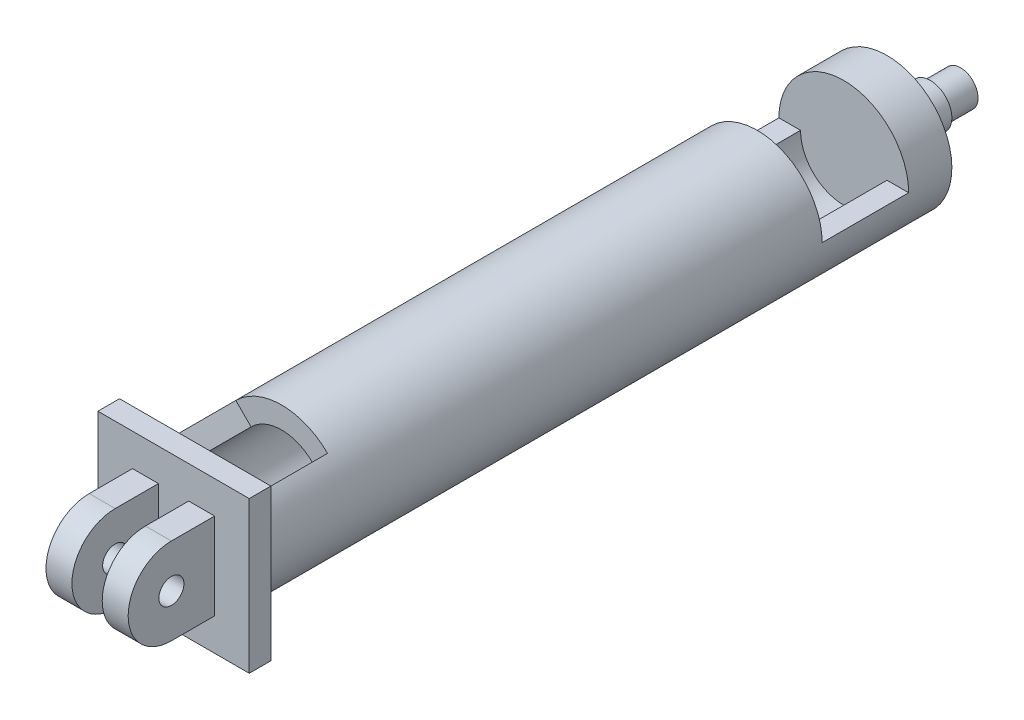
from build123d import *

# Parameters (mm, degrees)
SKETCH1_R           = 15
SKETCH1_R_2         = 10
BOSS_EXTRUDE1_DEPTH = 150
SKETCH2_W           = 35
SKETCH2_H           = 35
BOSS_EXTRUDE2_DEPTH = 5
CUT_EXTRUDE5_DEPTH  = 20
BOSS_EXTRUDE4_START = 10
SKETCH12_R          = 15
BOSS_EXTRUDE4_DEPTH = 10
SKETCH13_R          = 5
BOSS_EXTRUDE5_DEPTH = 10
CUT_EXTRUDE6_START  = 20
CUT_EXTRUDE6_DEPTH  = 20
SKETCH15_R          = 4.05
BOSS_EXTRUDE6_DEPTH = 7
SKETCH16_R          = 2.9
BOSS_EXTRUDE7_DEPTH = 35
SKETCH17_W          = 8
SKETCH17_H          = 27.5
SKETCH17_H_2        = 7.5
SKETCH17_W_2        = 7
CUT_EXTRUDE7_DEPTH  = 184.674984688
CUT_EXTRUDE11_DEPTH = 50
CUT_EXTRUDE13_START = 3
CUT_EXTRUDE13_DEPTH = 3


with BuildPart() as part:
    # Sketch1 → Boss-Extrude1 (new body)
    with BuildSketch(Plane.XY):
        Circle(SKETCH1_R)
        Circle(SKETCH1_R_2, mode=Mode.SUBTRACT)
    extrude(amount=BOSS_EXTRUDE1_DEPTH)

    # Sketch2 → Boss-Extrude2 (add)
    with BuildSketch(Plane.XY.offset(150)):
        Rectangle(SKETCH2_W, SKETCH2_H)
    extrude(amount=BOSS_EXTRUDE2_DEPTH)

    # Sketch10 → Cut-Extrude5 (cut)
    with BuildSketch(Plane(origin=(0, 0, 0), x_dir=(-1, 0, 0), z_dir=(0, 0, -1))):
        with BuildLine():
            Line((10, 0), (15, 0))
            ThreePointArc((15, 0), (0, 15), (-15, 0))
            Line((-15, 0), (-10, 0))
            ThreePointArc((-10, 0), (0, 10), (10, 0))
        make_face()
    extrude(amount=-CUT_EXTRUDE5_DEPTH, mode=Mode.SUBTRACT)

    # Sketch12 → Boss-Extrude4 (add)
    with BuildSketch(Plane(origin=(0, 0, 0), x_dir=(-1, 0, 0), z_dir=(0, 0, -1)).offset(BOSS_EXTRUDE4_START)):
        Circle(SKETCH12_R)
    extrude(amount=-BOSS_EXTRUDE4_DEPTH)

    # Sketch13 → Boss-Extrude5 (add)
    with BuildSketch(Plane(origin=(0, 0, -10), x_dir=(-1, 0, 0), z_dir=(0, 0, -1))):
        Circle(SKETCH13_R)
    extrude(amount=BOSS_EXTRUDE5_DEPTH)

    # Sketch14 → Cut-Extrude6 (cut)
    with BuildSketch(Plane(origin=(0, 0, 150), x_dir=(-1, 0, 0), z_dir=(0, 0, -1)).offset(CUT_EXTRUDE6_START)):
        with BuildLine():
            Line((-10.606601718, 10.606601718), (-7.071067812, 7.071067812))
            ThreePointArc((-7.071067812, 7.071067812), (0, 10), (7.071067812, 7.071067812))
            Line((7.071067812, 7.071067812), (10.606601718, 10.606601718))
            ThreePointArc((10.606601718, 10.606601718), (0, 15), (-10.606601718, 10.606601718))
        make_face()
    extrude(amount=-CUT_EXTRUDE6_DEPTH, mode=Mode.SUBTRACT)

    # Sketch15 → Boss-Extrude6 (add)
    with BuildSketch(Plane(origin=(0, 0, -20), x_dir=(-1, 0, 0), z_dir=(0, 0, -1))):
        Circle(SKETCH15_R)
    extrude(amount=BOSS_EXTRUDE6_DEPTH)

    # Sketch16 → Boss-Extrude7 (add)
    with BuildSketch(Plane.ZY.offset(17.5)):
        with BuildLine():
            Line((155, 10), (165, 10))
            ThreePointArc((165, 10), (175, 0), (165, -10))
            Line((165, -10), (155, -10))
            Line((155, -10), (155, 10))
        make_face()
        with Locations((165, 0)):
            Circle(SKETCH16_R, mode=Mode.SUBTRACT)
    extrude(amount=-BOSS_EXTRUDE7_DEPTH)

    # Sketch17 → Cut-Extrude7 (cut, through all)
    with BuildSketch(Plane.XY.offset(155)):
        with Locations((-13.5, -3.75)):
            Rectangle(SKETCH17_W, SKETCH17_H)
        with Locations((-13.5, 13.75)):
            Rectangle(SKETCH17_W, SKETCH17_H_2)
        with Locations((0, 13.75)):
            Rectangle(SKETCH17_W_2, SKETCH17_H_2)
        with Locations((0, -3.75)):
            Rectangle(SKETCH17_W_2, SKETCH17_H)
        with Locations((13.5, 13.75)):
            Rectangle(SKETCH17_W, SKETCH17_H_2)
        with Locations((13.5, -3.75)):
            Rectangle(SKETCH17_W, SKETCH17_H)
    extrude(amount=CUT_EXTRUDE7_DEPTH, mode=Mode.SUBTRACT)

    # Sketch20 → Cut-Extrude11 (cut)
    with BuildSketch(Plane(origin=(0, 0, -10), x_dir=(-1, 0, 0), z_dir=(0, 0, -1))):
        with BuildLine():
            ThreePointArc((1.5, -13.416407865), (0.751163705, -13.479085766), (0, -13.5))
            Line((0, -13.5), (0, -15))
            ThreePointArc((0, -15), (0.750941626, -14.981191097), (1.5, -14.924811557))
            Line((1.5, -14.924811557), (1.5, -13.416407865))
        make_face()
        with BuildLine():
            ThreePointArc((0, -13.5), (-0.751163705, -13.479085766), (-1.5, -13.416407865))
            Line((-1.5, -13.416407865), (-1.5, -14.924811557))
            ThreePointArc((-1.5, -14.924811557), (-0.750941626, -14.981191097), (0, -15))
            Line((0, -15), (0, -13.5))
        make_face()
    extrude(amount=-CUT_EXTRUDE11_DEPTH, mode=Mode.SUBTRACT)

    # Sketch23 → Cut-Extrude13 (cut)
    with BuildSketch(Plane(origin=(0, 0, 40), x_dir=(-1, 0, 0), z_dir=(0, 0, -1)).offset(CUT_EXTRUDE13_START)):
        with BuildLine():
            Line((-1.5, -14.924811557), (-1.5, -13.416407865))
            ThreePointArc((-1.5, -13.416407865), (-4.76963682, -12.629353293), (-7.743281891, -11.058552598))
            Line((-7.743281891, -11.058552598), (-8.603646545, -12.287280664))
            ThreePointArc((-8.603646545, -12.287280664), (-5.221116804, -14.062003389), (-1.5, -14.924811557))
        make_face()
    extrude(amount=-CUT_EXTRUDE13_DEPTH, mode=Mode.SUBTRACT)


solid = part.part
